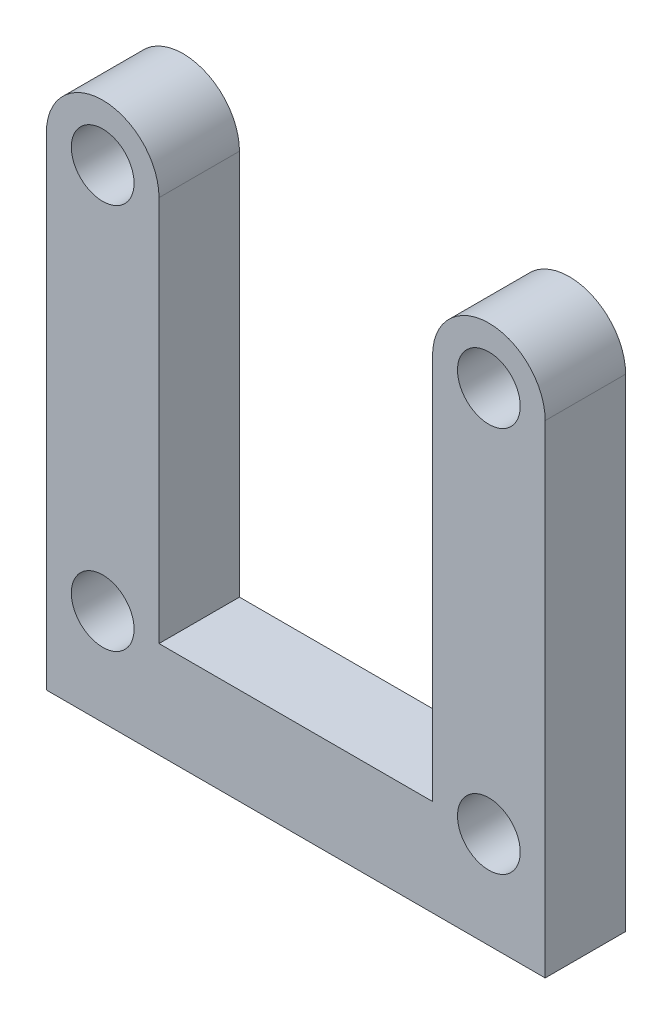
from build123d import *

# Parameters (mm, degrees)
SKETCH1_R           = 1.95
BOSS_EXTRUDE1_DEPTH = 5
SKETCH4_R           = 1.25
CUT_EXTRUDE3_DEPTH  = 5.5


with BuildPart() as part:
    # Sketch1 → Boss-Extrude1 (new body)
    with BuildSketch(Plane.XY):
        with BuildLine():
            ThreePointArc((-8.5, 12), (-12, 15.5), (-15.5, 12))
            Line((-15.5, 12), (-15.5, -12))
            Line((-15.5, -12), (-15.5, -12.97105896))
            Line((-15.5, -12.97105896), (-15.5, -18))
            Line((-15.5, -18), (0, -18))
            Line((0, -18), (15.5, -18))
            Line((15.5, -18), (15.5, -12))
            Line((15.5, -12), (15.5, 12))
            ThreePointArc((15.5, 12), (12, 15.5), (8.5, 12))
            Line((8.5, 12), (8.5, -12))
            Line((8.5, -12), (0, -12))
            Line((0, -12), (-8.5, -12))
            Line((-8.5, -12), (-8.5, 12))
        make_face()
        with Locations((-12, -12)):
            Circle(SKETCH1_R, mode=Mode.SUBTRACT)
        with Locations((12, -12)):
            Circle(SKETCH1_R, mode=Mode.SUBTRACT)
        with Locations((-12, 12)):
            Circle(SKETCH1_R, mode=Mode.SUBTRACT)
        with Locations((12, 12)):
            Circle(SKETCH1_R, mode=Mode.SUBTRACT)
    extrude(amount=BOSS_EXTRUDE1_DEPTH)

    # Sketch4 → Cut-Extrude3 (cut)
    with BuildSketch(Plane.XZ.offset(18)):
        with Locations(Location((-8, 2.5, 0), (0, 0, 270))):
            Circle(SKETCH4_R)
        with Locations(Location((8, 2.5, 0), (0, 0, 270))):
            Circle(SKETCH4_R)
    extrude(amount=-CUT_EXTRUDE3_DEPTH, mode=Mode.SUBTRACT)


solid = part.part
